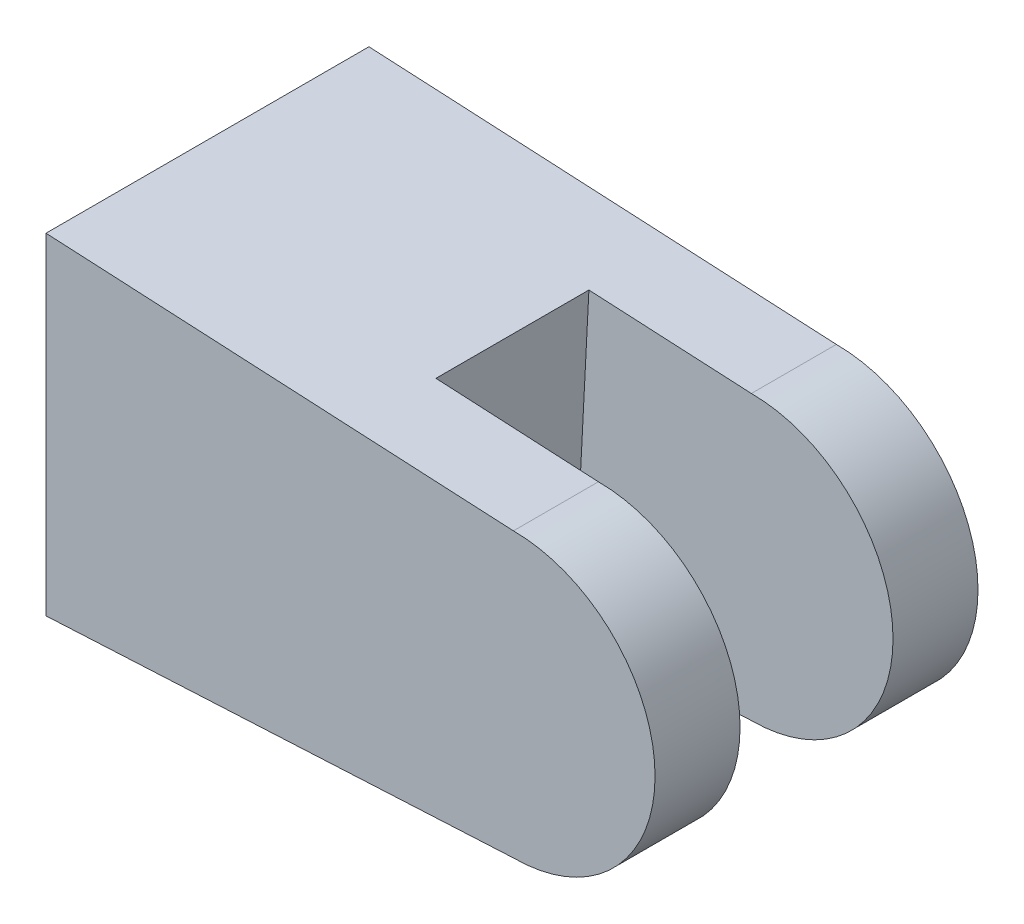
from build123d import *

# Parameters (mm, degrees)
BOSS_EXTRUDE1_DEPTH     = 57
SKETCH2_R               = 37.5
BOSS_EXTRUDE2_DEPTH     = 2
CUT_EXTRUDE1_DEPTH      = 210.155863705
CUT_EXTRUDE1_DEPTH_BACK = 210.155863705
SKETCH3_W               = 110
SKETCH3_H               = 54


with BuildPart() as part:
    # Sketch1 → Boss-Extrude1 (new, symmetric)
    with BuildSketch(Plane.XY):
        with BuildLine():
            Line((-165, -58.5), (-165, 58.5))
            Line((-165, 58.5), (0, 50))
            ThreePointArc((0, 50), (50, 0), (0, -50))
            Line((0, -50), (-165, -58.5))
        make_face()
    extrude(amount=BOSS_EXTRUDE1_DEPTH, both=True)

    # Sketch2 → Boss-Extrude2 (add)
    with BuildSketch(Plane.ZY.offset(165)):
        Circle(SKETCH2_R)
    extrude(amount=BOSS_EXTRUDE2_DEPTH)

    # Sketch3 → Cut-Extrude1 (cut, two sides: drawn at the far end of the back side and taken through both)
    with BuildSketch(Plane(origin=(2.568940095, 49.867660662, 0), x_dir=(0.9986757297720645, -0.05144693153371229, 0), z_dir=(0.051446931533712284, 0.9986757297720644, 0)).offset(-CUT_EXTRUDE1_DEPTH_BACK)):
        with Locations((-5, 0)):
            Rectangle(SKETCH3_W, SKETCH3_H)
    extrude(amount=CUT_EXTRUDE1_DEPTH + CUT_EXTRUDE1_DEPTH_BACK, mode=Mode.SUBTRACT)


solid = part.part
